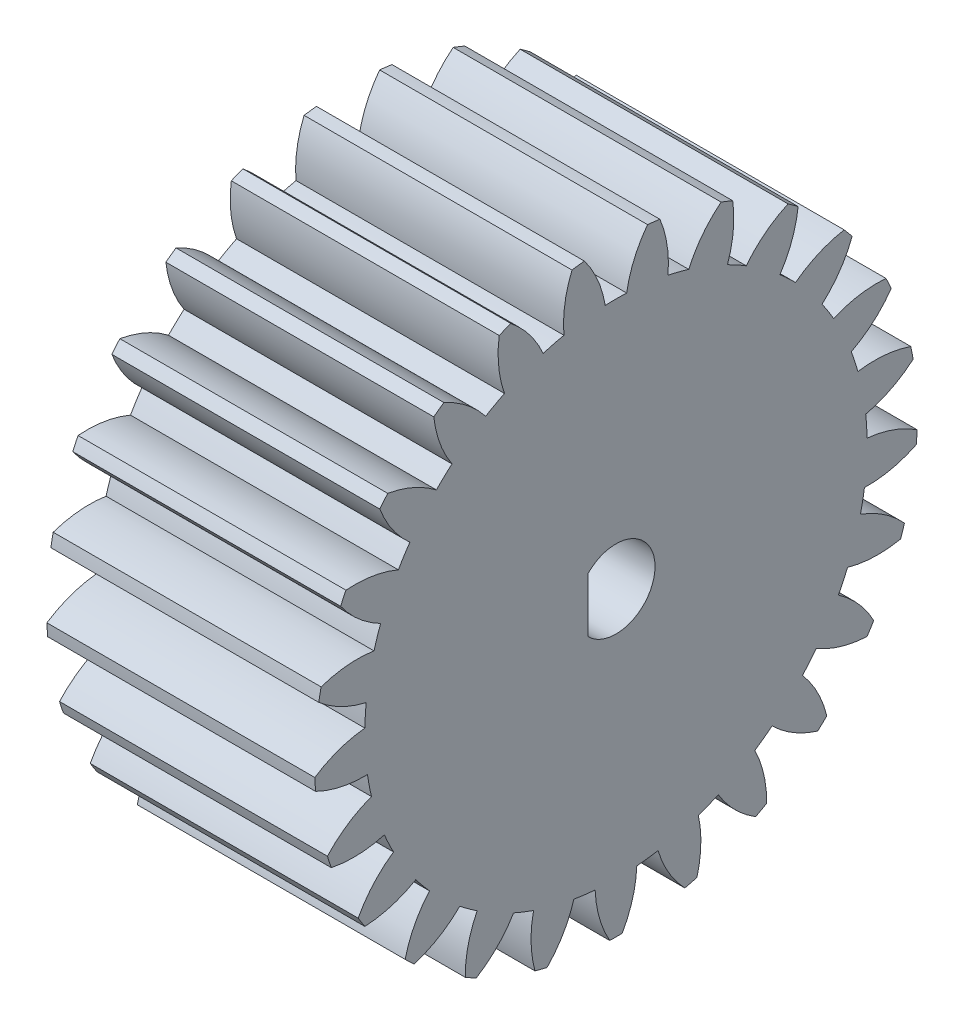
from build123d import *

# Parameters (mm, degrees)
BASPROSKE_W         = 12
BASPROSKE_H         = 13.5
TOOTHCUT_DEPTH      = 23.549944568
TEETHCUTS_COUNT     = 25
TEETHCUTS_ANGLE     = 345.6
BORSKE_R            = 1.5
BORE_DEPTH          = 50.0000508
CUT_EXTRUDE1_DEPTH  = 23.542777009
BOSS_EXTRUDE2_DEPTH = 12


with BuildPart() as part:
    # BasProSke → Base-Revolve (revolve)
    with BuildSketch(Plane(origin=(0, 0, 0), x_dir=(1, 0, 0), z_dir=(0, 1, 0)), mode=Mode.PRIVATE) as base_revolve_sk:
        with Locations((6, 6.75)):
            Rectangle(BASPROSKE_W, BASPROSKE_H)
    revolve(base_revolve_sk.sketch.rotate(Axis((-10, 0, 0), (1, 0, 0)), 180), axis=Axis((-10, 0, 0), (1, 0, 0)))

    # TooCutSke → ToothCut (cut, through all)
    with BuildSketch(Plane(origin=(0, 0, 0), x_dir=(0, 0, -1), z_dir=(1, 0, 0))):
        with BuildLine():
            ThreePointArc((0.480087995, 11.238750665), (0, 11.249), (-0.480087995, 11.238750665))
            ThreePointArc((-0.480087995, 11.238750665), (-0.821124963, 12.40220054), (-1.432168974, 13.449361962))
            ThreePointArc((-1.432168974, 13.449361962), (0, 13.5254), (1.432168974, 13.449361962))
            ThreePointArc((1.432168974, 13.449361962), (0.821124963, 12.40220054), (0.480087995, 11.238750665))
        make_face()
    toothcut = extrude(amount=TOOTHCUT_DEPTH, mode=Mode.SUBTRACT)

    # TeethCuts: ToothCut ×25 about axis
    teethcuts_axis = Axis((-10, 0, 0), (1, 0, 0))
    for i in range(1, TEETHCUTS_COUNT):
        add(toothcut.rotate(teethcuts_axis, i * TEETHCUTS_ANGLE / (TEETHCUTS_COUNT - 1)), mode=Mode.SUBTRACT)

    # BorSke → Bore (cut, symmetric)
    with BuildSketch(Plane(origin=(0, 0, 0), x_dir=(0, 0, -1), z_dir=(1, 0, 0))):
        with Locations(Location((0, 0, 0), (0, 0, 180))):
            Circle(BORSKE_R)
    extrude(amount=BORE_DEPTH, both=True, mode=Mode.SUBTRACT)

    # Sketch1 → Cut-Extrude1 (cut, through all)
    with BuildSketch(Plane(origin=(12, 0, 0), x_dir=(0, 0, -1), z_dir=(1, 0, 0))):
        with BuildLine():
            Line((-1.25, 1.224744871), (-1.25, -1.224744871))
            ThreePointArc((-1.25, -1.224744871), (1.75, 0), (-1.25, 1.224744871))
        make_face()
    extrude(amount=-CUT_EXTRUDE1_DEPTH, mode=Mode.SUBTRACT)

    # Sketch1<4> → Boss-Extrude2 (add, through all)
    with BuildSketch(Plane(origin=(12, 0, 0), x_dir=(0, 0, -1), z_dir=(1, 0, 0))):
        with BuildLine():
            Line((-1.25, -0.829156198), (-1.25, 0.829156198))
            ThreePointArc((-1.25, 0.829156198), (-1.5, 0), (-1.25, -0.829156198))
        make_face()
    extrude(amount=-BOSS_EXTRUDE2_DEPTH)


solid = part.part
